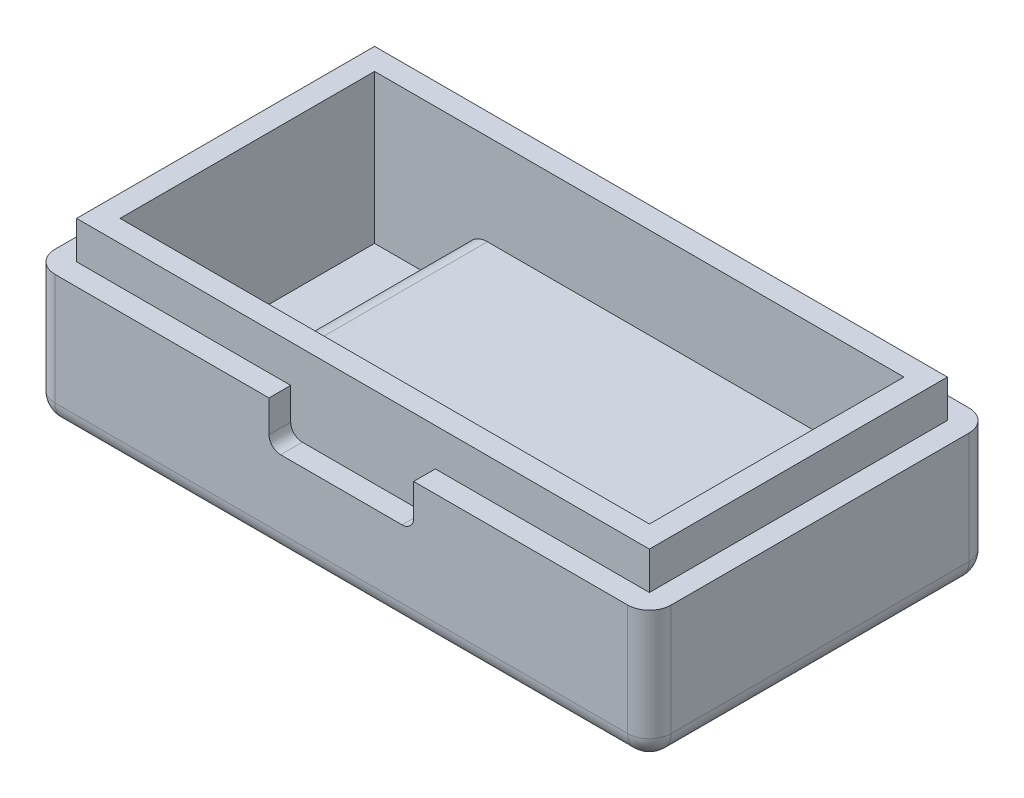
from build123d import *

# Parameters (mm, degrees)
SKETCH2_W           = 42.6
SKETCH2_H           = 23.6
BOSS_EXTRUDE1_DEPTH = 11.8
SKETCH4_W           = 30.3
SKETCH4_H           = 17.6
CUT_EXTRUDE2_DEPTH  = 6.3
SKETCH5_W           = 6.3
SKETCH5_H           = 17.6
CUT_EXTRUDE3_DEPTH  = 10.3
SKETCH6_W           = 42.6
SKETCH6_H           = 23.6
SKETCH6_W_2         = 39.6
SKETCH6_H_2         = 20.6
CUT_EXTRUDE4_DEPTH  = 2.6
FILLET1_R           = 1.5
FILLET2_R           = 1.5
CUT_EXTRUDE5_DEPTH  = 1.5
CUT_EXTRUDE6_START  = -1.5
CUT_EXTRUDE6_DEPTH  = 1.5


with BuildPart() as part:
    # Sketch2 → Boss-Extrude1 (new body)
    with BuildSketch(Plane(origin=(0, 0, 0), x_dir=(1, 0, 0), z_dir=(0, 1, 0))):
        with Locations((21.3, 11.8)):
            Rectangle(SKETCH2_W, SKETCH2_H)
    extrude(amount=BOSS_EXTRUDE1_DEPTH)

    # Sketch4 → Cut-Extrude2 (cut)
    with BuildSketch(Plane(origin=(0, 11.8, 0), x_dir=(1, 0, 0), z_dir=(0, 1, 0))):
        with Locations((24.45, 11.8)):
            Rectangle(SKETCH4_W, SKETCH4_H)
    extrude(amount=-CUT_EXTRUDE2_DEPTH, mode=Mode.SUBTRACT)

    # Sketch5 → Cut-Extrude3 (cut)
    with BuildSketch(Plane(origin=(0, 11.8, 0), x_dir=(1, 0, 0), z_dir=(0, 1, 0))):
        with Locations((6.15, 11.8)):
            Rectangle(SKETCH5_W, SKETCH5_H)
    extrude(amount=-CUT_EXTRUDE3_DEPTH, mode=Mode.SUBTRACT)

    # Sketch6 → Cut-Extrude4 (cut)
    with BuildSketch(Plane(origin=(0, 11.8, 0), x_dir=(1, 0, 0), z_dir=(0, 1, 0))):
        with Locations((21.3, 11.8)):
            Rectangle(SKETCH6_W, SKETCH6_H)
        with Locations((21.3, 11.8)):
            Rectangle(SKETCH6_W_2, SKETCH6_H_2, mode=Mode.SUBTRACT)
    extrude(amount=-CUT_EXTRUDE4_DEPTH, mode=Mode.SUBTRACT)

    # Fillet1
    fillet1_edges = [part.edges().sort_by_distance(p)[0] for p in [
        (0, 4.6, -23.6),
        (42.6, 4.6, -23.6),
        (42.6, 4.6, 0),
        (0, 4.6, 0),
        (21.3, 0, -23.6),
        (42.6, 0, -11.8),
        (21.3, 0, 0),
        (0, 0, -11.8),
    ]]
    fillet(fillet1_edges, radius=FILLET1_R)

    # Fillet2
    fillet2_edges = [part.edges().sort_by_distance(p)[0] for p in [
        (9.3, 5.5, -11.8),
    ]]
    fillet(fillet2_edges, radius=FILLET2_R)

    # Sketch8 → Cut-Extrude5 (cut)
    with BuildSketch(Plane.XY):
        with BuildLine():
            Line((16.3, 9.2), (26.3, 9.2))
            Line((26.3, 9.2), (26.3, 7))
            ThreePointArc((26.3, 7), (26.065685425, 6.434314575), (25.5, 6.2))
            Line((25.5, 6.2), (17.1, 6.2))
            ThreePointArc((17.1, 6.2), (16.534314575, 6.434314575), (16.3, 7))
            Line((16.3, 7), (16.3, 9.2))
        make_face()
    extrude(amount=-CUT_EXTRUDE5_DEPTH, mode=Mode.SUBTRACT)

    # Sketch9 → Cut-Extrude6 (cut)
    with BuildSketch(Plane(origin=(0, 0, -23.6), x_dir=(-1, 0, 0), z_dir=(0, 0, -1)).offset(CUT_EXTRUDE6_START)):
        with BuildLine():
            Line((-16.3, 9.2), (-26.3, 9.2))
            Line((-26.3, 9.2), (-26.3, 7))
            ThreePointArc((-26.3, 7), (-26.065685425, 6.434314575), (-25.5, 6.2))
            Line((-25.5, 6.2), (-17.1, 6.2))
            ThreePointArc((-17.1, 6.2), (-16.534314575, 6.434314575), (-16.3, 7))
            Line((-16.3, 7), (-16.3, 9.2))
        make_face()
    extrude(amount=CUT_EXTRUDE6_DEPTH, mode=Mode.SUBTRACT)


solid = part.part
